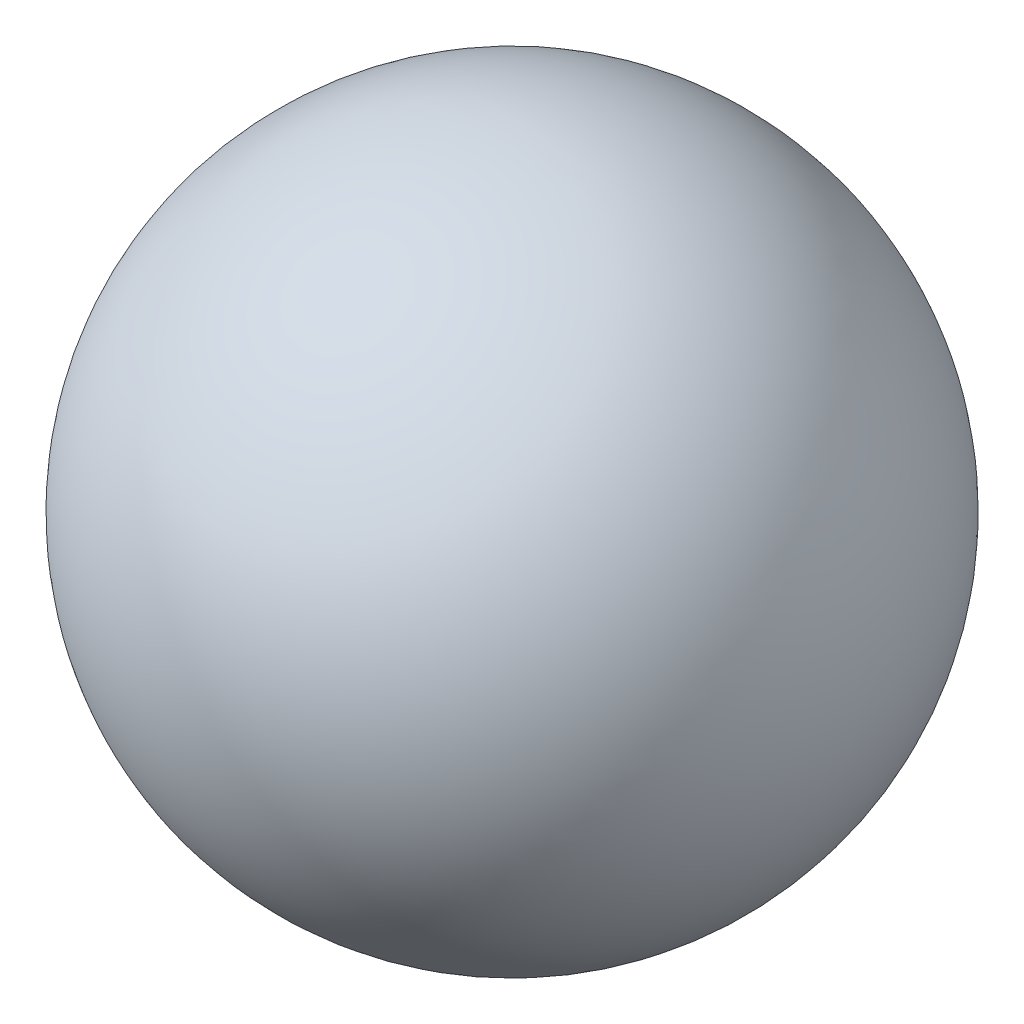
from build123d import *

# Parameters (mm, degrees)
SHELL1_T = 2.5


with BuildPart() as part:
    # Sketch1 → Revolve2 (revolve)
    with BuildSketch(Plane(origin=(0, 0, 0), x_dir=(1, 0, 0), z_dir=(0, 1, 0))):
        with BuildLine():
            Line((0, -46), (0, 46))
            ThreePointArc((0, 46), (-46, 0), (0, -46))
        make_face()
    revolve(axis=Axis((0, 0, 46), (0, 0, -1)))

    # Shell1 (no face opened: a closed hollow body)
    add(offset(amount=-SHELL1_T, mode=Mode.PRIVATE), mode=Mode.SUBTRACT)


solid = part.part
